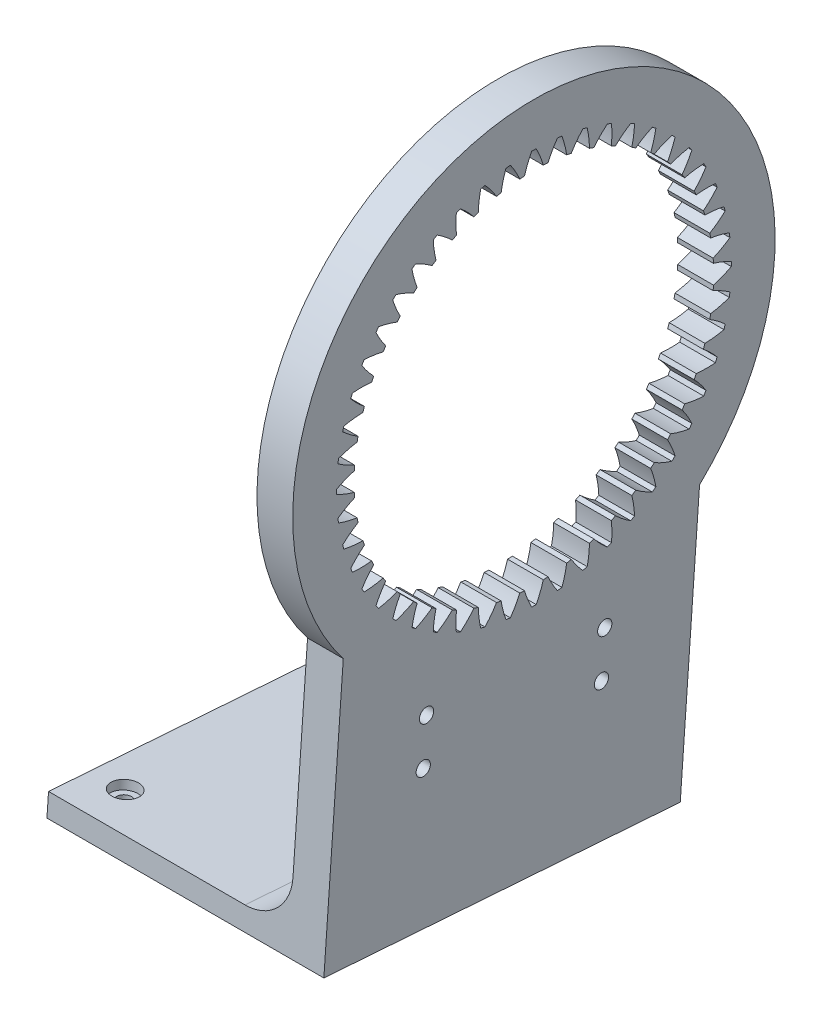
from build123d import *

# Parameters (mm, degrees)
BASPROSKE_W                  = 8
BASPROSKE_H                  = 13.75
TOOTHCUT_DEPTH               = 77.785415282
TEETHCUTS_COUNT              = 48
ESQUISSE1_R                  = 1.6
ENL_V_MAT_EXTRU_1_DEPTH      = 10
R_P_TITION_CIRCULAIRE1_COUNT = 6
BOSS_EXTRU_1_DEPTH           = 8
ESQUISSE3_R                  = 2.47870488
BOSS_EXTRU_2_DEPTH           = 8
R_P_TITION_CIRCULAIRE3_COUNT = 6
ESQUISSE4_R                  = 1.6
ENL_V_MAT_EXTRU_2_DEPTH      = 10
BOSS_EXTRU_3_START           = -8
BOSS_EXTRU_3_DEPTH           = 54
CONG_1_R                     = 10
ESQUISSE6_R                  = 3
ENL_V_MAT_EXTRU_3_DEPTH      = 2
ESQUISSE7_R                  = 1.6
ENL_V_MAT_EXTRU_4_DEPTH      = 5


with BuildPart() as part:
    # BasProSke → Base-Revolve (revolve)
    with BuildSketch(Plane(origin=(0, 0, 0), x_dir=(1, 0, 0), z_dir=(0, 1, 0)), mode=Mode.PRIVATE) as base_revolve_sk:
        with Locations((4, 47.125)):
            Rectangle(BASPROSKE_W, BASPROSKE_H)
    revolve(base_revolve_sk.sketch.rotate(Axis((-10, 0, 0), (1, 0, 0)), 180), axis=Axis((-10, 0, 0), (1, 0, 0)))

    # TooCutSke → ToothCut (cut, through all)
    with BuildSketch(Plane(origin=(0, 0, 0), x_dir=(0, 0, -1), z_dir=(1, 0, 0))):
        with BuildLine():
            ThreePointArc((2.110563708, 40.169191752), (1.409972129, 42.218958462), (0.501952026, 44.185648987))
            ThreePointArc((0.501952026, 44.185648987), (0, 44.1885), (-0.501952026, 44.185648987))
            ThreePointArc((-0.501952026, 44.185648987), (-1.409972129, 42.218958462), (-2.110563708, 40.169191752))
            ThreePointArc((-2.110563708, 40.169191752), (0, 40.2246), (2.110563708, 40.169191752))
        make_face()
    toothcut = extrude(amount=TOOTHCUT_DEPTH, mode=Mode.SUBTRACT)

    # TeethCuts: ToothCut ×48 about axis
    teethcuts_axis = Axis((0, 0, 0), (1, 0, 0))
    for i in range(1, TEETHCUTS_COUNT):
        add(toothcut.rotate(teethcuts_axis, i * 360 / TEETHCUTS_COUNT), mode=Mode.SUBTRACT)

    # Esquisse1 → Enlèv. mat.-Extru.1 (cut)
    with BuildSketch(Plane(origin=(8, 0, 0), x_dir=(0, 0, -1), z_dir=(1, 0, 0))):
        with Locations((3.532945449, 48.560151654)):
            Circle(ESQUISSE1_R)
    enl_v_mat_extru_1 = extrude(amount=-ENL_V_MAT_EXTRU_1_DEPTH, mode=Mode.SUBTRACT)

    # Répétition circulaire1: Enlèv. mat.-Extru.1 ×6 about axis
    r_p_tition_circulaire1_axis = Axis((0, 0, 0), (1, 0, 0))
    for i in range(1, R_P_TITION_CIRCULAIRE1_COUNT):
        add(enl_v_mat_extru_1.rotate(r_p_tition_circulaire1_axis, i * 360 / R_P_TITION_CIRCULAIRE1_COUNT), mode=Mode.SUBTRACT)

    # Esquisse2 → Boss.-Extru.1 (add, through all)
    with BuildSketch(Plane(origin=(8, 0, 0), x_dir=(0, 0, -1), z_dir=(1, 0, 0))):
        with BuildLine():
            ThreePointArc((37.084015632, -39.252716907), (-4.163996104, -53.8392156), (-42.67861512, -33.083769607))
            Line((-42.67861512, -33.083769607), (-47.025569896, -92.832437158))
            Line((-47.025569896, -92.832437158), (32.763541134, -98.63741443))
            Line((32.763541134, -98.63741443), (37.084015632, -39.252716907))
        make_face()
    extrude(amount=-BOSS_EXTRU_1_DEPTH)

    # Esquisse3 → Boss.-Extru.2 (add)
    with BuildSketch(Plane(origin=(8, 0, 0), x_dir=(0, 0, -1), z_dir=(1, 0, 0))):
        with Locations((-3.532945449, -48.560151654)):
            Circle(ESQUISSE3_R)
    boss_extru_2 = extrude(amount=-BOSS_EXTRU_2_DEPTH)

    # Répétition circulaire3: Boss.-Extru.2 ×6 about axis
    r_p_tition_circulaire3_axis = Axis((8, 0, 0), (-1, 0, 0))
    for i in range(1, R_P_TITION_CIRCULAIRE3_COUNT):
        add(boss_extru_2.rotate(r_p_tition_circulaire3_axis, i * 360 / R_P_TITION_CIRCULAIRE3_COUNT))

    # Esquisse4 → Enlèv. mat.-Extru.2 (cut)
    with BuildSketch(Plane.ZY):
        with Locations((-15.859275657, -56.333678875)):
            Circle(ESQUISSE4_R)
        with Locations((-15.116462763, -66.306052164)):
            Circle(ESQUISSE4_R)
        with Locations((24.773030391, -63.334800586)):
            Circle(ESQUISSE4_R)
        with Locations((24.030217496, -53.362427297)):
            Circle(ESQUISSE4_R)
    extrude(amount=-ENL_V_MAT_EXTRU_2_DEPTH, mode=Mode.SUBTRACT)

    # Esquisse5 → Boss.-Extru.3 (add)
    with BuildSketch(Plane(origin=(8, 0, 0), x_dir=(0, 0, -1), z_dir=(1, 0, 0)).offset(BOSS_EXTRU_3_START)):
        Polygon((-47.025569896, -92.832437158), (32.763541134, -98.63741443), (33.126352213, -93.650594991), (-46.662758816, -87.845617719), align=None)
    extrude(amount=-BOSS_EXTRU_3_DEPTH)

    # Congé1
    cong_1_edges = [part.edges().sort_by_distance(p)[0] for p in [
        (0, -90.748106355, 6.768203301),
    ]]
    fillet(cong_1_edges, radius=CONG_1_R)

    # Esquisse6 → Enlèv. mat.-Extru.3 (cut)
    with BuildSketch(Plane(origin=(0, -90.760113796, 6.603161647), x_dir=(1, 0, 0), z_dir=(0, 0.9973638878678069, -0.07256221590616323))):
        with Locations(Location((-29, -0.165477872, 0), (0, 0, 270))):
            Circle(ESQUISSE6_R)
        with Locations(Location((-46.5, -30.476367005, 0), (0, 0, 270))):
            Circle(ESQUISSE6_R)
        with Locations(Location((-46.5, 30.14541126, 0), (0, 0, 270))):
            Circle(ESQUISSE6_R)
    extrude(amount=-ENL_V_MAT_EXTRU_3_DEPTH, mode=Mode.SUBTRACT)

    # Esquisse7 → Enlèv. mat.-Extru.4 (cut)
    with BuildSketch(Plane(origin=(0, -90.760113796, 6.603161647), x_dir=(1, 0, 0), z_dir=(0, 0.9973638878678069, -0.07256221590616323))):
        with Locations(Location((-29, -0.165477872, 0), (0, 0, 270))):
            Circle(ESQUISSE7_R)
        with Locations(Location((-46.5, 30.14541126, 0), (0, 0, 270))):
            Circle(ESQUISSE7_R)
        with Locations(Location((-46.5, -30.476367005, 0), (0, 0, 270))):
            Circle(ESQUISSE7_R)
    extrude(amount=-ENL_V_MAT_EXTRU_4_DEPTH, mode=Mode.SUBTRACT)


solid = part.part
